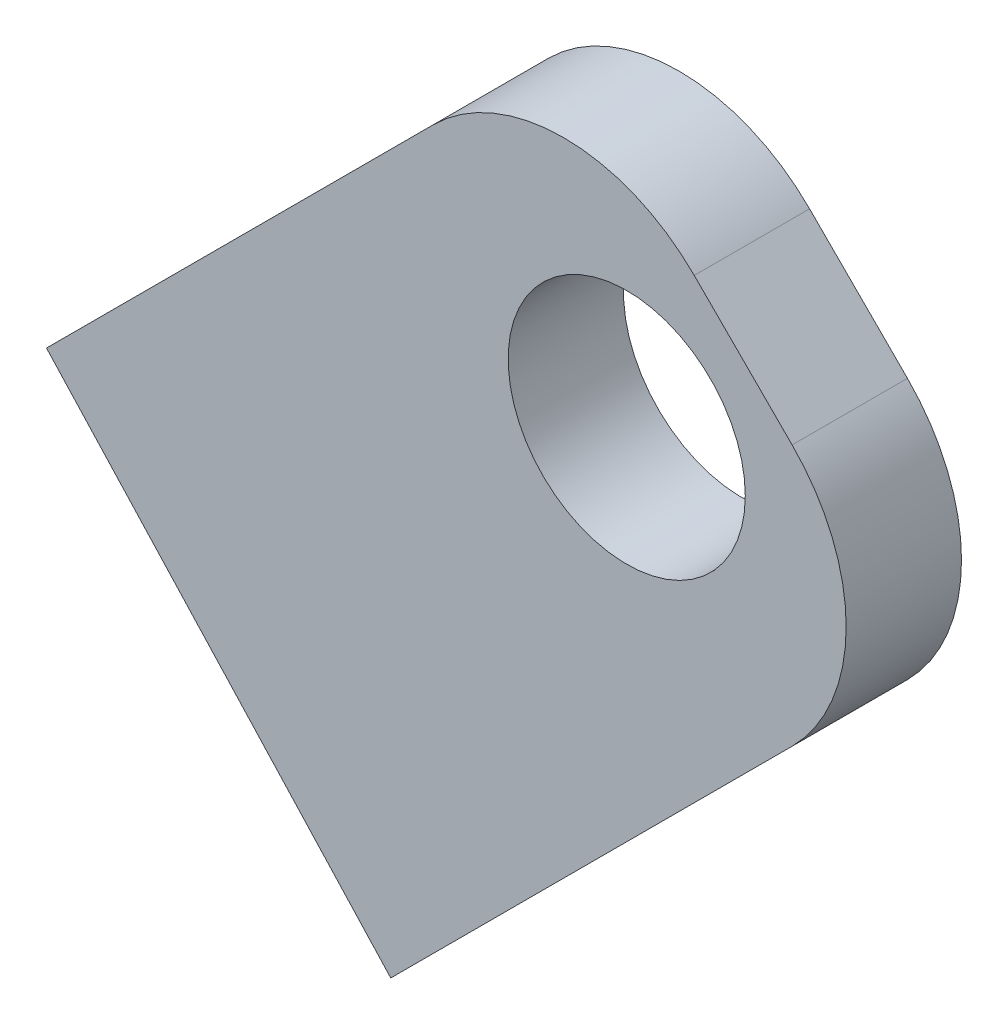
from build123d import *

# Parameters (mm, degrees)
SKETCH1_R           = 3.2639
BOSS_EXTRUDE1_DEPTH = 3.175


with BuildPart() as part:
    # Sketch1 → Boss-Extrude1 (new body)
    with BuildSketch(Plane.XY):
        with BuildLine():
            Line((-1.530517905, -11.20781273), (9.518928271, -0.158366555))
            ThreePointArc((9.518928271, -0.158366555), (11.006825822, 3.433735894), (9.518928271, 7.025838342))
            Line((9.518928271, 7.025838342), (6.824851434, 9.719915179))
            ThreePointArc((6.824851434, 9.719915179), (3.232748986, 11.20781273), (-0.359353462, 9.719915179))
            Line((-0.359353462, 9.719915179), (-11.006825822, -0.927557181))
            Line((-11.006825822, -0.927557181), (-1.530517905, -11.20781273))
        make_face()
        with Locations((4.965938417, 5.166925325)):
            Circle(SKETCH1_R, mode=Mode.SUBTRACT)
    extrude(amount=BOSS_EXTRUDE1_DEPTH)


solid = part.part
